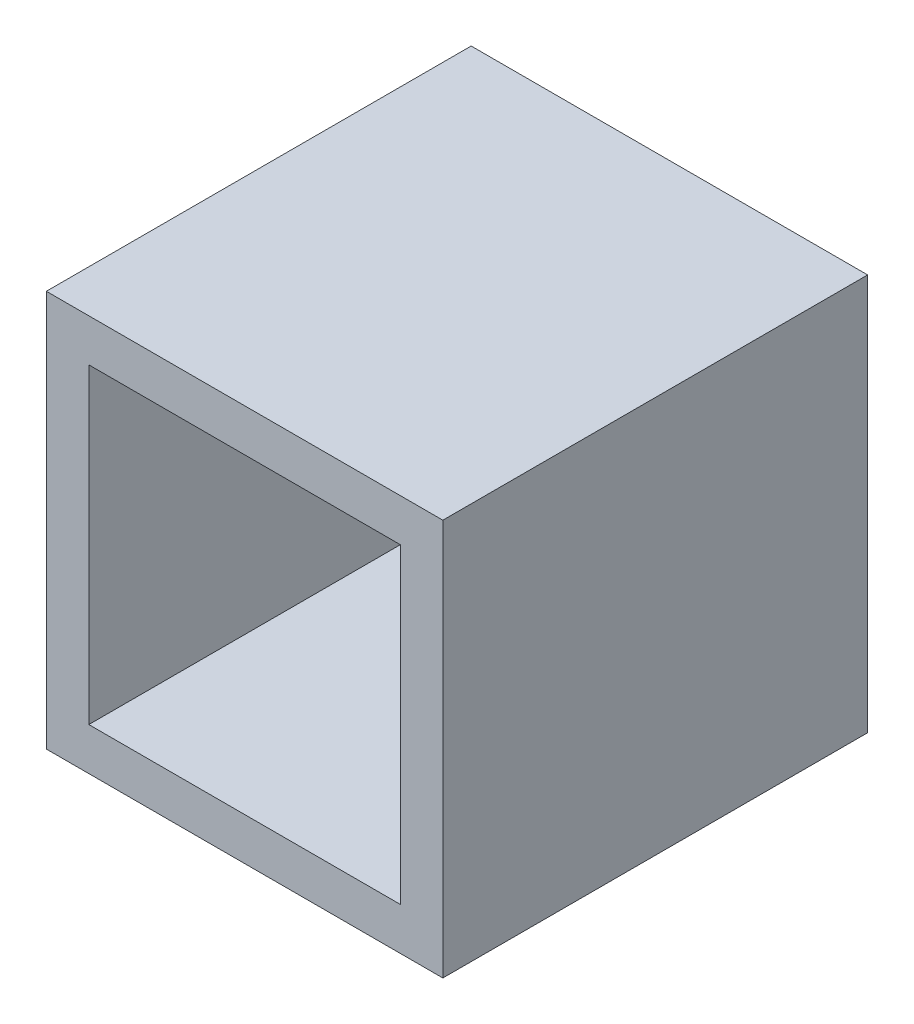
from build123d import *

# Parameters (mm, degrees)
SKETCH3_W           = 70
SKETCH3_H           = 70
SKETCH3_W_2         = 55
SKETCH3_H_2         = 55
BOSS_EXTRUDE4_DEPTH = 75


with BuildPart() as part:
    # Sketch3 → Boss-Extrude4 (new body)
    with BuildSketch(Plane.XY):
        with Locations((-67.630036597, 3.554945105)):
            Rectangle(SKETCH3_W, SKETCH3_H)
        with Locations((-67.630036597, 3.554945105)):
            Rectangle(SKETCH3_W_2, SKETCH3_H_2, mode=Mode.SUBTRACT)
    extrude(amount=-BOSS_EXTRUDE4_DEPTH)


solid = part.part
